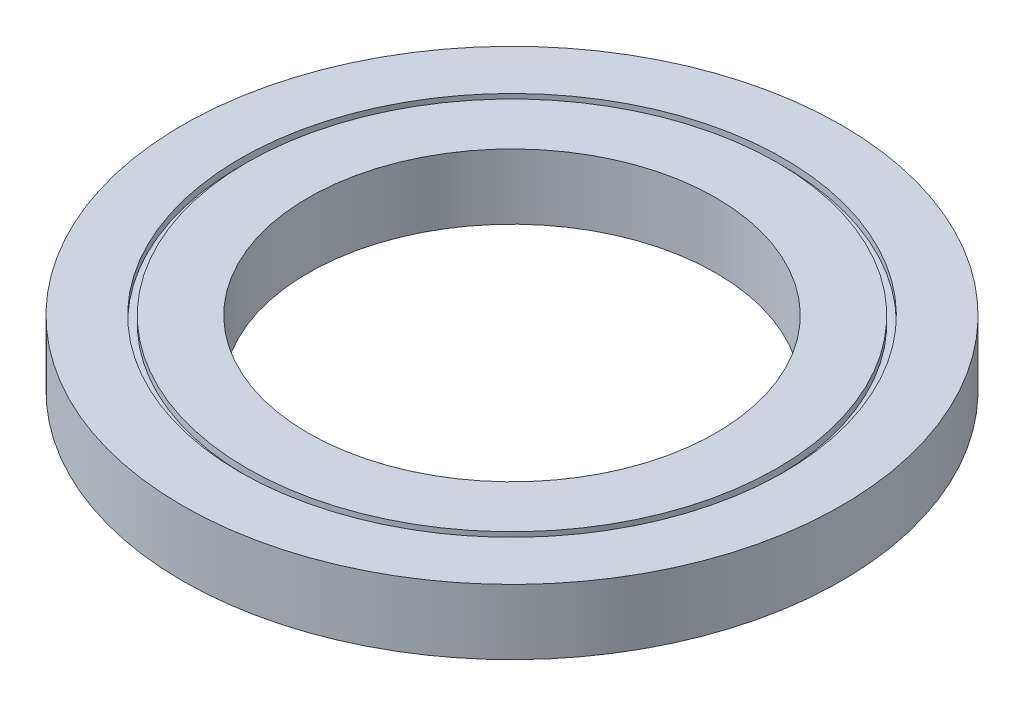
from build123d import *

# Parameters (mm, degrees)
SKETCH1_R           = 48.5
SKETCH1_R_2         = 30
BOSS_EXTRUDE1_DEPTH = 9.59
SKETCH2_R           = 40
SKETCH2_R_2         = 39
CUT_EXTRUDE1_DEPTH  = 1
CUT_EXTRUDE2_START  = -1
SKETCH3_R           = 40
SKETCH3_R_2         = 39
CUT_EXTRUDE2_DEPTH  = 1


with BuildPart() as part:
    # Sketch1 → Boss-Extrude1 (new body)
    with BuildSketch(Plane(origin=(0, 0, 0), x_dir=(1, 0, 0), z_dir=(0, 1, 0))):
        with Locations(Location((0, 0, 0), (0, 0, 270))):
            Circle(SKETCH1_R)
        with Locations(Location((0, 0, 0), (0, 0, 270))):
            Circle(SKETCH1_R_2, mode=Mode.SUBTRACT)
    extrude(amount=BOSS_EXTRUDE1_DEPTH)

    # Sketch2 → Cut-Extrude1 (cut)
    with BuildSketch(Plane(origin=(0, 0, 0), x_dir=(1, 0, 0), z_dir=(0, 1, 0))):
        with Locations(Location((0, 0, 0), (0, 0, 270))):
            Circle(SKETCH2_R)
        with Locations(Location((0, 0, 0), (0, 0, 270))):
            Circle(SKETCH2_R_2, mode=Mode.SUBTRACT)
    extrude(amount=CUT_EXTRUDE1_DEPTH, mode=Mode.SUBTRACT)

    # Sketch3 → Cut-Extrude2 (cut)
    with BuildSketch(Plane(origin=(0, 9.59, 0), x_dir=(1, 0, 0), z_dir=(0, 1, 0)).offset(CUT_EXTRUDE2_START)):
        with Locations(Location((0, 0, 0), (0, 0, 270))):
            Circle(SKETCH3_R)
        with Locations(Location((0, 0, 0), (0, 0, 270))):
            Circle(SKETCH3_R_2, mode=Mode.SUBTRACT)
    extrude(amount=CUT_EXTRUDE2_DEPTH, mode=Mode.SUBTRACT)


solid = part.part
